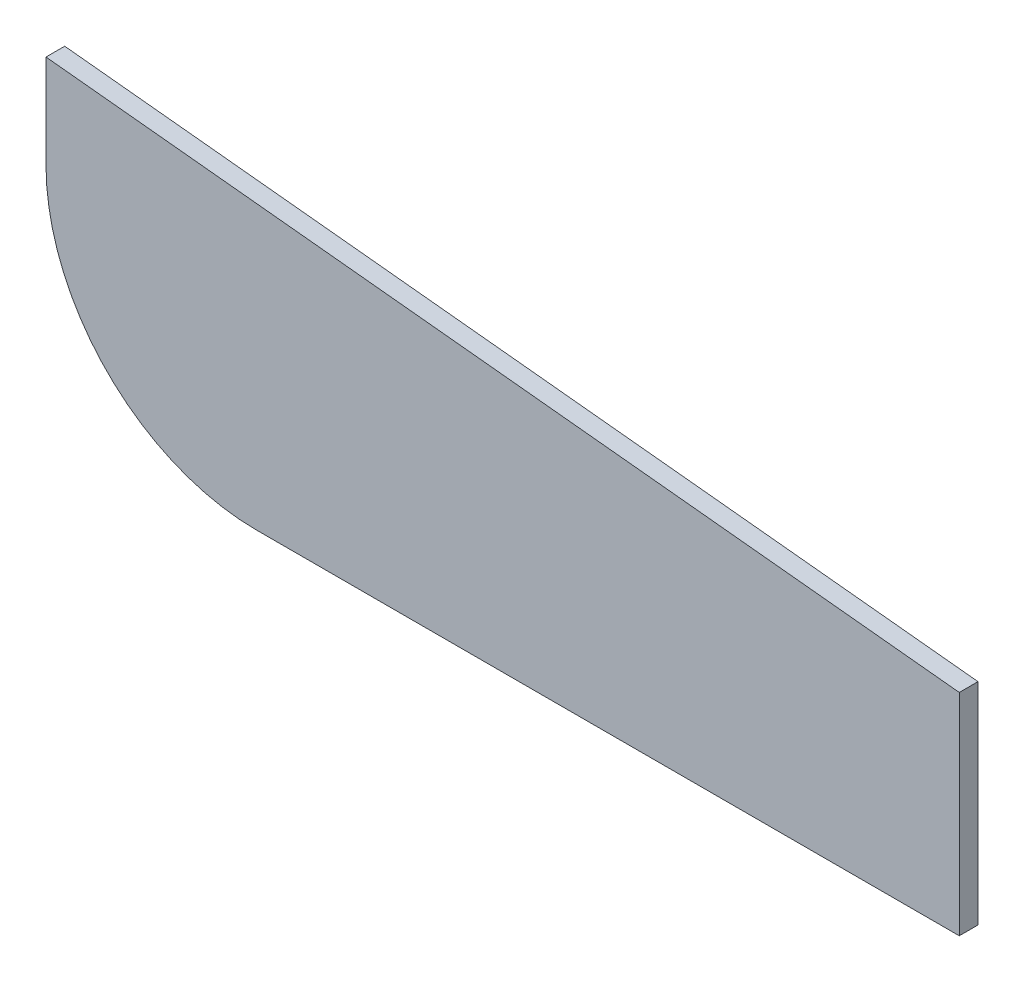
from build123d import *

# Parameters (mm, degrees)
SKETCH1_W           = 195
SKETCH1_H           = 4
BOSS_EXTRUDE1_DEPTH = 65
CUT_EXTRUDE1_DEPTH  = 10
CUT_EXTRUDE2_DEPTH  = 10


with BuildPart() as part:
    # Sketch1 → Boss-Extrude1 (new body)
    with BuildSketch(Plane(origin=(0, 0, 0), x_dir=(1, 0, 0), z_dir=(0, 1, 0))):
        Rectangle(SKETCH1_W, SKETCH1_H)
    extrude(amount=-BOSS_EXTRUDE1_DEPTH)

    # Sketch2 → Cut-Extrude1 (cut)
    with BuildSketch(Plane.XY.offset(2)):
        Polygon((-97.5, 0), (97.5, -20), (97.5, 0), align=None)
    extrude(amount=-CUT_EXTRUDE1_DEPTH, mode=Mode.SUBTRACT)

    # Sketch3 → Cut-Extrude2 (cut)
    with BuildSketch(Plane.XY.offset(2)):
        with BuildLine():
            Line((-97.5, -20), (-97.5, -65))
            Line((-97.5, -65), (-52.5, -65))
            ThreePointArc((-52.5, -65), (-84.319805153, -51.819805153), (-97.5, -20))
        make_face()
    extrude(amount=-CUT_EXTRUDE2_DEPTH, mode=Mode.SUBTRACT)


solid = part.part
